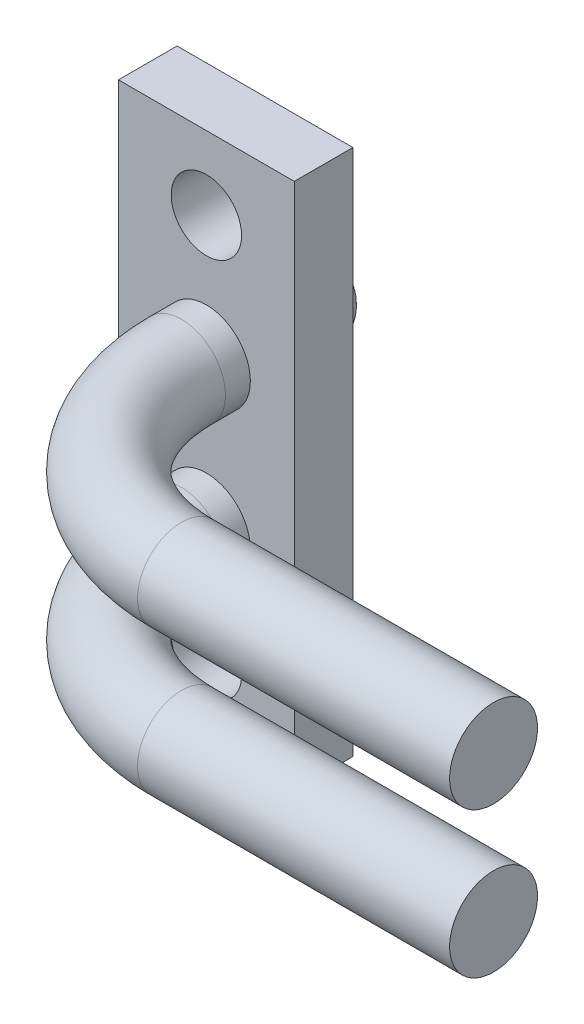
from build123d import *

# Parameters (mm, degrees)
SKETCH1_W           = 6
SKETCH1_H           = 18
BOSS_EXTRUDE1_DEPTH = 2
SKETCH2_R           = 1.5
BOSS_EXTRUDE2_DEPTH = 2.5
SKETCH6_W           = 2.684515713
SKETCH6_H           = 5.34346461
CUT_EXTRUDE2_DEPTH  = 10
FILLET1_R           = 1.5
SKETCH3_R           = 1.5
SKETCH5_R           = 1.2
CUT_EXTRUDE1_DEPTH  = 21.686831601


with BuildPart() as part:
    # Sketch1 → Boss-Extrude1 (new body)
    with BuildSketch(Plane.XY):
        Rectangle(SKETCH1_W, SKETCH1_H)
    extrude(amount=BOSS_EXTRUDE1_DEPTH)

    # Sketch2 → Boss-Extrude2 (add)
    with BuildSketch(Plane(origin=(0, 0, 0), x_dir=(-1, 0, 0), z_dir=(0, 0, -1))):
        with Locations((0, 2.35)):
            Circle(SKETCH2_R)
        with Locations((0, -2.62)):
            Circle(SKETCH2_R)
    extrude(amount=BOSS_EXTRUDE2_DEPTH)

    # Sketch6 → Cut-Extrude2 (cut)
    with BuildSketch(Plane.ZY.offset(3)):
        with Locations((-3.442257857, -3.208635448)):
            Rectangle(SKETCH6_W, SKETCH6_H)
    extrude(amount=-CUT_EXTRUDE2_DEPTH, mode=Mode.SUBTRACT)

    # Fillet1
    fillet1_edges = [part.edges().sort_by_distance(p)[0] for p in [
        (1.5, 2.35, -2.5),
        (1.5, -2.62, -2.1),
    ]]
    fillet(fillet1_edges, radius=FILLET1_R)

    # Sweep1: sweep along a path in Sketch4
    with BuildLine(Plane(origin=(0, 2.35, 0), x_dir=(-1, 0, 0), z_dir=(0, 1, 0))) as sweep1_path:
        Line((0, 2), (0, 2.85))
        ThreePointArc((0, 2.85), (-1.757359313, 7.092640687), (-6, 8.85))
        Line((-6, 8.85), (-16.65, 8.85))
    # Sketch3 → Sweep1 (sweep)
    with BuildSketch(Plane.XY.offset(2)):
        with Locations((0, -2.62)):
            Circle(SKETCH3_R)
        with Locations((0, 2.35)):
            Circle(SKETCH3_R)
    sweep(path=sweep1_path.line)

    # Sketch5 → Cut-Extrude1 (cut, through all)
    with BuildSketch(Plane.XY.offset(2)):
        with Locations((0, 6.5)):
            Circle(SKETCH5_R)
        with Locations(Location((0, -6.5, 0), (0, 0, 180))):
            Circle(SKETCH5_R)
    extrude(amount=-CUT_EXTRUDE1_DEPTH, mode=Mode.SUBTRACT)


solid = part.part
